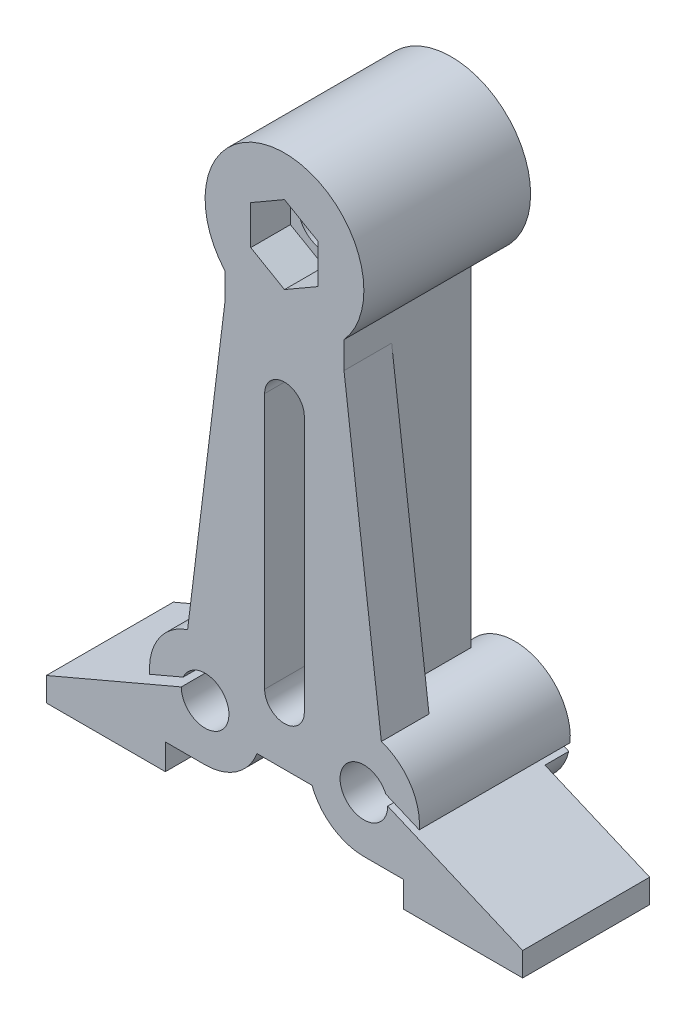
from build123d import *
from build123d.topology import SkipClean

# Parameters (mm, degrees)
SKETCH1_R               = 7
BOSS_EXTRUDE1_DEPTH     = 16
BOSS_EXTRUDE2_START     = -3
SKETCH3_R               = 7
BOSS_EXTRUDE2_DEPTH     = 3
CUT_EXTRUDE1_DEPTH      = 39.354433
CUT_EXTRUDE1_DEPTH_BACK = 39.354433
SKETCH2_R               = 3
BOSS_EXTRUDE3_START     = -6
BOSS_EXTRUDE3_DEPTH     = 6
BOSS_EXTRUDE4_START     = -16
BOSS_EXTRUDE4_DEPTH     = 16
BOSS_EXTRUDE5_START     = -21
BOSS_EXTRUDE5_DEPTH     = 21
CUT_EXTRUDE2_DEPTH      = 5
CUT_EXTRUDE3_START      = -21
CUT_EXTRUDE3_DEPTH      = 5
CUT_EXTRUDE4_DEPTH      = 67.585002
CUT_EXTRUDE4_DEPTH_BACK = 67.585002
SKETCH6_R               = 3.25


with BuildPart() as part:
    # Sketch1 → Boss-Extrude1 (new body)
    with BuildSketch(Plane.XY):
        with BuildLine():
            ThreePointArc((16.808917, -9.124391), (14.337584, -12.994121), (10, -14.5))
            Line((10, -14.5), (15, -14.5))
            Line((15, -14.5), (15, -17.75))
            Line((15, -17.75), (30, -17.75))
            Line((30, -17.75), (30, -14.75))
            Line((30, -14.75), (16.808917, -9.124391))
        make_face()
        with Locations((10, -7.5)):
            Circle(SKETCH1_R)
        with BuildLine():
            Line((0, -10), (3.461652, -10))
            ThreePointArc((3.461652, -10), (3, -7.5), (3.461652, -5))
            Line((3.461652, -5), (0, -5))
            Line((0, -5), (0, -10))
        make_face()
    extrude(amount=BOSS_EXTRUDE1_DEPTH)

    # Sketch3 → Boss-Extrude2 (add)
    with BuildSketch(Plane.XY.offset(BOSS_EXTRUDE2_START)):
        with Locations(Location((10, -7.5, 0), (0, 0, 159.075168))):
            Circle(SKETCH3_R)
    extrude(amount=BOSS_EXTRUDE2_DEPTH)

    # Sketch2 → Cut-Extrude1 (cut, two sides: drawn at the far end of the back side and taken through both)
    with BuildSketch(Plane.XY.offset(-CUT_EXTRUDE1_DEPTH_BACK)):
        with Locations((10, -7.5)):
            Circle(SKETCH2_R)
        with BuildLine():
            ThreePointArc((12.752773, -6.307423), (12.937543, -6.891034), (13, -7.5))
            Line((13, -7.5), (16.959704, -9.188697))
            Line((16.959704, -9.188697), (17.35199, -8.268854))
            Line((17.35199, -8.268854), (12.752773, -6.307423))
        make_face()
    extrude(amount=CUT_EXTRUDE1_DEPTH + CUT_EXTRUDE1_DEPTH_BACK, mode=Mode.SUBTRACT)

    # Sketch4 → Boss-Extrude3 (add)
    with BuildSketch(Plane.XY.offset(16).offset(BOSS_EXTRUDE3_START)):
        with BuildLine():
            Line((12.202752, -0.855613), (7.5, 37.25))
            Line((7.5, 37.25), (7.5, -0.961652))
            ThreePointArc((7.5, -0.961652), (9.842202, -0.501779), (12.202752, -0.855613))
        make_face()
    extrude(amount=BOSS_EXTRUDE3_DEPTH)

    # Sketch4<6> → Boss-Extrude4 (add)
    with BuildSketch(Plane.XY.offset(16).offset(BOSS_EXTRUDE4_START)):
        with BuildLine():
            Line((7.5, 37.25), (7.5, 40.635622))
            ThreePointArc((7.5, 40.635622), (4.114378, 38.135622), (0, 37.25))
            Line((0, 37.25), (0, 32.25))
            ThreePointArc((0, 32.25), (1.767767, 31.517767), (2.5, 29.75))
            Line((2.5, 29.75), (2.5, -2.5))
            ThreePointArc((2.5, -2.5), (1.767767, -4.267767), (0, -5))
            Line((0, -5), (3.461652, -5))
            ThreePointArc((3.461652, -5), (5.050253, -2.550253), (7.5, -0.961652))
            Line((7.5, -0.961652), (7.5, 37.25))
        make_face()
    extrude(amount=BOSS_EXTRUDE4_DEPTH)

    # Sketch4<7> → Boss-Extrude5 (add)
    with BuildSketch(Plane.XY.offset(16).offset(BOSS_EXTRUDE5_START)):
        with BuildLine():
            ThreePointArc((0, 37.25), (4.114378, 38.135622), (7.5, 40.635622))
            ThreePointArc((7.5, 40.635622), (9.114378, 51.364378), (0, 57.25))
            Line((0, 57.25), (0, 49.65))
            ThreePointArc((0, 49.65), (2.4, 47.25), (0, 44.85))
            Line((0, 44.85), (0, 37.25))
        make_face()
    extrude(amount=BOSS_EXTRUDE5_DEPTH)

    # Mirror1: part across plane


with BuildPart() as part_1:
    with SkipClean():  # the faces are left unmerged after this step: merging them gives an invalid solid
        add(part.part)
        add(part.part.mirror(Plane(origin=(0, 0, 0), x_dir=(0, 0, 1), z_dir=(1, 0, 0))))

    # Sketch5 → Cut-Extrude2 (cut)
    with SkipClean():  # the faces are left unmerged after this step: merging them gives an invalid solid
        with BuildSketch(Plane.XY.offset(16)):
            Polygon((4.25, 49.703739), (0, 52.157477), (-4.25, 49.703739), (-4.25, 44.796261), (0, 42.342523), (4.25, 44.796261), align=None)
        extrude(amount=-CUT_EXTRUDE2_DEPTH, mode=Mode.SUBTRACT)

    # Sketch5<2> → Cut-Extrude3 (cut)
    with SkipClean():  # the faces are left unmerged after this step: merging them gives an invalid solid
        with BuildSketch(Plane.XY.offset(16).offset(CUT_EXTRUDE3_START)):
            Polygon((4.25, 49.703739), (0, 52.157477), (-4.25, 49.703739), (-4.25, 44.796261), (0, 42.342523), (4.25, 44.796261), align=None)
        extrude(amount=CUT_EXTRUDE3_DEPTH, mode=Mode.SUBTRACT)

    # Sketch6 → Cut-Extrude4 (cut, two sides: drawn at the far end of the back side and taken through both)
    with SkipClean():  # the faces are left unmerged after this step: merging them gives an invalid solid
        with BuildSketch(Plane.XY.offset(11).offset(-CUT_EXTRUDE4_DEPTH_BACK)):
            with Locations((0, 47.25)):
                Circle(SKETCH6_R)
        extrude(amount=CUT_EXTRUDE4_DEPTH + CUT_EXTRUDE4_DEPTH_BACK, mode=Mode.SUBTRACT)


solid = part_1.part
